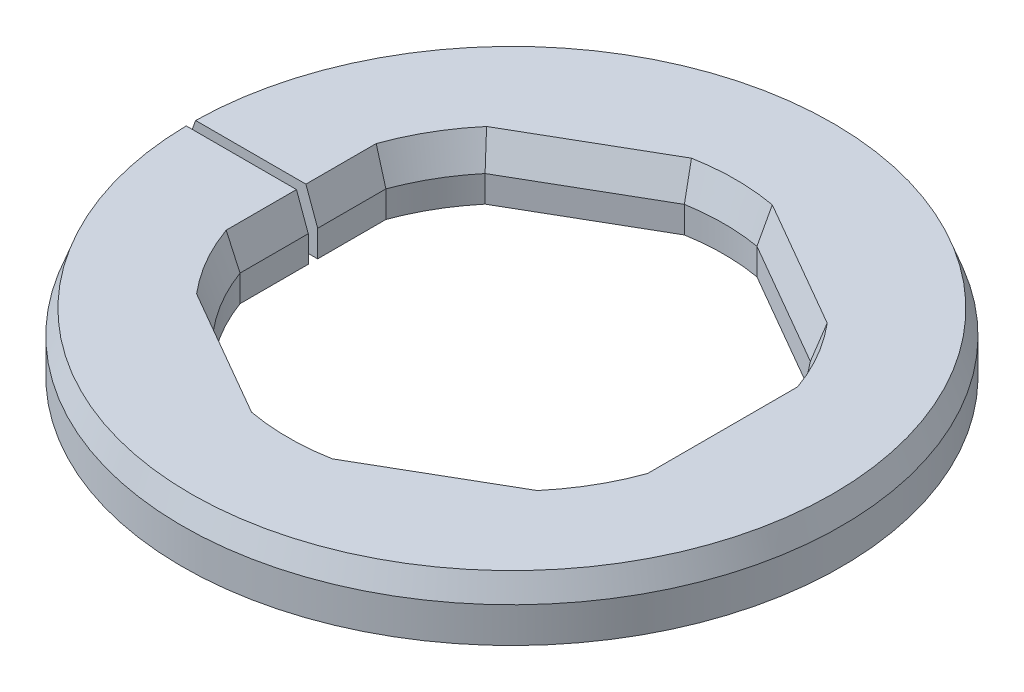
from build123d import *

# Parameters (mm, degrees)
SKETCH_1_R          = 14
EXTRUDE_1_DEPTH     = 2.5
CHAMFER_4_SIZE      = 0.5
CHAMFER_4_SIZE2     = 1.37373871
SKETCH_3_W          = 19.861324318
SKETCH_3_H          = 0.4
CUT_EXTRUDE_1_DEPTH = 20.956202044
CHAMFER_5_SIZE      = 1
CHAMFER_5_SIZE2     = 0.363970234


with BuildPart() as part:
    # Эскиз1 → Бобышка-Вытянуть1 (new body)
    with BuildSketch(Plane(origin=(0, 0, 0), x_dir=(1, 0, 0), z_dir=(0, 1, 0))):
        with Locations(Location((0, -1e-09, 0), (0, 0, 270))):
            Circle(SKETCH_1_R)
        with BuildLine():
            Line((-6.907932165, 5.768923055), (-1.542067835, 8.866906269))
            ThreePointArc((-1.542067835, 8.866906269), (0, 9), (1.542067835, 8.866906269))
            Line((1.542067835, 8.866906269), (6.907932165, 5.768923055))
            ThreePointArc((6.907932165, 5.768923055), (7.794228634, 4.5), (8.45, 3.097983215))
            Line((8.45, 3.097983215), (8.45, -3.097983215))
            ThreePointArc((8.45, -3.097983215), (7.794228634, -4.5), (6.907932165, -5.768923055))
            Line((6.907932165, -5.768923055), (1.542067835, -8.866906269))
            ThreePointArc((1.542067835, -8.866906269), (0, -9), (-1.542067835, -8.866906269))
            Line((-1.542067835, -8.866906269), (-6.907932165, -5.768923054))
            ThreePointArc((-6.907932165, -5.768923054), (-7.794228634, -4.5), (-8.45, -3.097983215))
            Line((-8.45, -3.097983215), (-8.45, 3.097983215))
            ThreePointArc((-8.45, 3.097983215), (-7.794228634, 4.5), (-6.907932165, 5.768923055))
        make_face(mode=Mode.SUBTRACT)
    extrude(amount=EXTRUDE_1_DEPTH)

    # Фаска4
    chamfer_4_edges = [part.edges().sort_by_distance(p)[0] for p in [
        (-7.794228634, 2.5, -4.5),
        (-8.45, 2.5, 0),
        (-7.794228634, 2.5, 4.5),
        (-4.225, 2.5, 7.317914662),
        (0, 2.5, 9),
        (4.225, 2.5, 7.317914662),
        (7.794228634, 2.5, 4.5),
        (8.45, 2.5, 0),
        (7.794228634, 2.5, -4.5),
        (4.225, 2.5, -7.317914662),
        (0, 2.5, -9),
        (-4.225, 2.5, -7.317914662),
    ]]
    chamfer_4_side = [part.faces().sort_by_distance(p)[0] for p in [
        (0, 2.5, -13.604020202),
    ]]
    chamfer(chamfer_4_edges, length=CHAMFER_4_SIZE, length2=CHAMFER_4_SIZE2, reference=chamfer_4_side[0])

    # Эскиз3 → Вырез-Вытянуть1 (cut, through all)
    with BuildSketch(Plane(origin=(0, 2.5, 0), x_dir=(1, 0, 0), z_dir=(0, 1, 0))):
        with Locations((-7.474129941, 0)):
            Rectangle(SKETCH_3_W, SKETCH_3_H)
    extrude(amount=-CUT_EXTRUDE_1_DEPTH, mode=Mode.SUBTRACT)

    # Фаска5
    chamfer_5_edges = [part.edges().sort_by_distance(p)[0] for p in [
        (9.969954865, 2.5, -9.828529899),
    ]]
    chamfer_5_side = [part.faces().sort_by_distance(p)[0] for p in [
        (9.969954865, 1.25, -9.828529899),
    ]]
    chamfer(chamfer_5_edges, length=CHAMFER_5_SIZE, length2=CHAMFER_5_SIZE2, reference=chamfer_5_side[0])


solid = part.part
